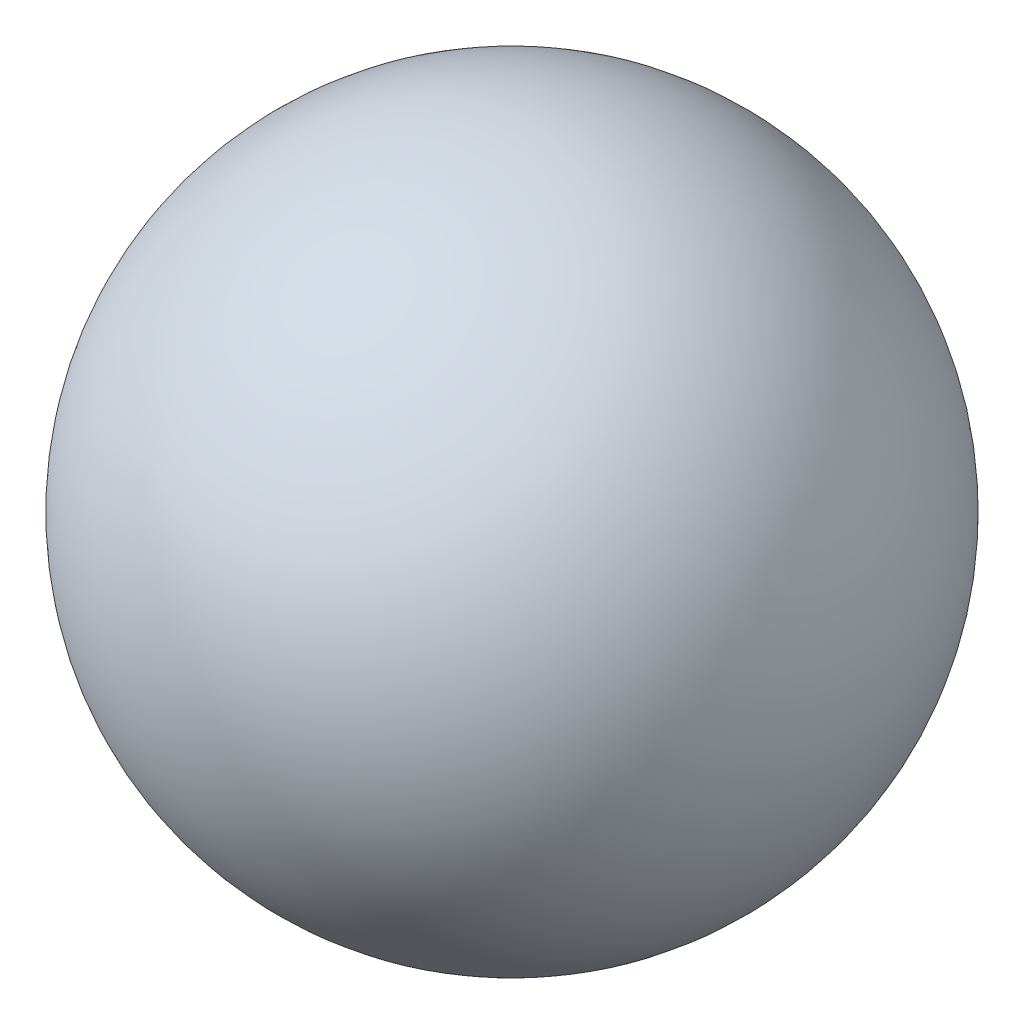
from build123d import *


with BuildPart() as part:
    # Sketch1 → Revolve1 (revolve)
    with BuildSketch(Plane.XY):
        with BuildLine():
            Line((0, -4), (0, 4))
            ThreePointArc((0, 4), (4, 0), (0, -4))
        make_face()
    revolve(axis=Axis((0, -4, 0), (0, 1, 0)))


solid = part.part
